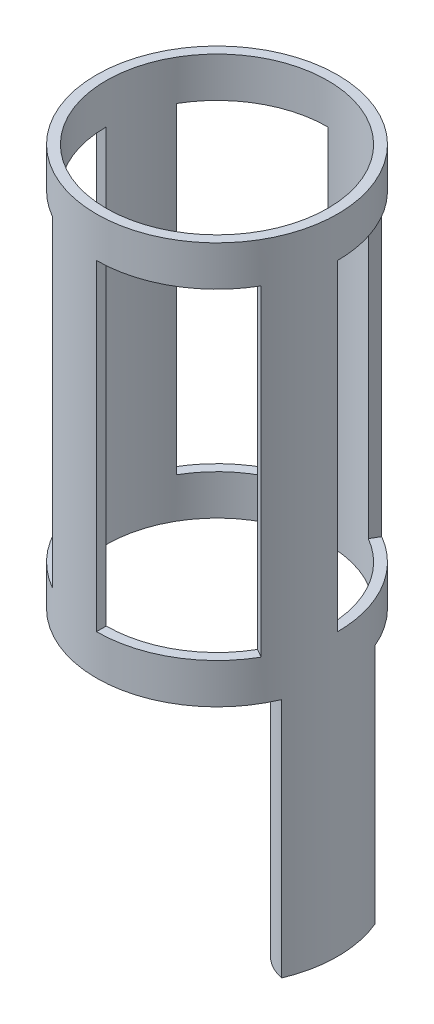
from build123d import *
from build123d.topology import SkipClean

# Parameters (mm, degrees)
SKETCH1_R           = 38.1
SKETCH1_R_2         = 35
BOSS_EXTRUDE1_DEPTH = 12.7
BOSS_EXTRUDE2_DEPTH = 127
BOSS_EXTRUDE3_START = -12.7
SKETCH2_R           = 38.1
SKETCH2_R_2         = 35
BOSS_EXTRUDE3_DEPTH = 12.7
BOSS_EXTRUDE4_START = 76.2
BOSS_EXTRUDE4_DEPTH = 76.2


with BuildPart() as part:
    # Sketch1 → Boss-Extrude1 (new body)
    with BuildSketch(Plane(origin=(0, 0, 0), x_dir=(1, 0, 0), z_dir=(0, 1, 0))):
        Circle(SKETCH1_R)
        Circle(SKETCH1_R_2, mode=Mode.SUBTRACT)
    extrude(amount=BOSS_EXTRUDE1_DEPTH)

    # Sketch1<3> → Boss-Extrude2 (add)
    with SkipClean():  # the faces are left unmerged after this step: merging them gives an invalid solid
        with BuildSketch(Plane(origin=(0, 0, 0), x_dir=(1, 0, 0), z_dir=(0, 1, 0))):
            with BuildLine():
                ThreePointArc((-19.05, -32.995567884), (-9.861005618, -36.801773982), (0, -38.1))
                Line((0, -38.1), (0, -35))
                ThreePointArc((0, -35), (-9.058666579, -33.80740392), (-17.5, -30.310889132))
                Line((-17.5, -30.310889132), (-19.05, -32.995567884))
            make_face()
            with BuildLine():
                Line((30.310889132, -17.5), (32.995567884, -19.05))
                ThreePointArc((32.995567884, -19.05), (36.801773982, -9.861005618), (38.1, 0))
                Line((38.1, 0), (35, 0))
                ThreePointArc((35, 0), (33.80740392, -9.058666579), (30.310889132, -17.5))
            make_face()
            with BuildLine():
                ThreePointArc((-32.995567884, 19.05), (-36.801773982, 9.861005618), (-38.1, 0))
                Line((-38.1, 0), (-35, 0))
                ThreePointArc((-35, 0), (-33.80740392, 9.058666579), (-30.310889132, 17.5))
                Line((-30.310889132, 17.5), (-32.995567884, 19.05))
            make_face()
            with BuildLine():
                Line((17.5, 30.310889132), (19.05, 32.995567884))
                ThreePointArc((19.05, 32.995567884), (9.861005618, 36.801773982), (0, 38.1))
                Line((0, 38.1), (0, 35))
                ThreePointArc((0, 35), (9.058666579, 33.80740392), (17.5, 30.310889132))
            make_face()
        extrude(amount=BOSS_EXTRUDE2_DEPTH)

    # Sketch2 → Boss-Extrude3 (add)
    with SkipClean():  # the faces are left unmerged after this step: merging them gives an invalid solid
        with BuildSketch(Plane(origin=(0, 127, 0), x_dir=(1, 0, 0), z_dir=(0, 1, 0)).offset(BOSS_EXTRUDE3_START)):
            Circle(SKETCH2_R)
            Circle(SKETCH2_R_2, mode=Mode.SUBTRACT)
        extrude(amount=BOSS_EXTRUDE3_DEPTH)

    # Sketch3 → Boss-Extrude4 (add)
    with SkipClean():  # the faces are left unmerged after this step: merging them gives an invalid solid
        with BuildSketch(Plane.XZ.offset(BOSS_EXTRUDE4_START)):
            with BuildLine():
                ThreePointArc((35.147244094, -14.70650307), (38.1, 0), (35.147244094, 14.70650307))
                ThreePointArc((35.147244094, 14.70650307), (23.1, 0), (35.147244094, -14.70650307))
            make_face()
            with BuildLine():
                ThreePointArc((33.10984252, 13.080455968), (35.6, 0), (33.10984252, -13.080455968))
                ThreePointArc((33.10984252, -13.080455968), (24.1, 0), (33.10984252, 13.080455968))
            make_face(mode=Mode.SUBTRACT)
        extrude(amount=-BOSS_EXTRUDE4_DEPTH)


solid = part.part
